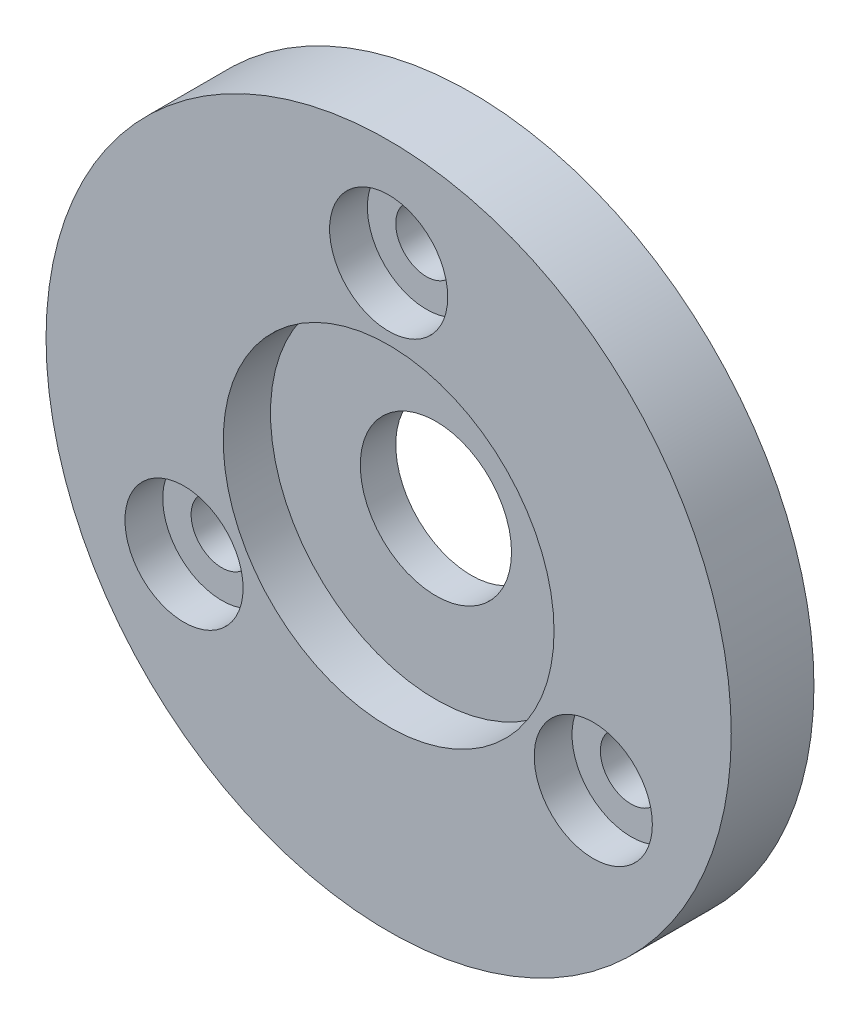
from build123d import *

# Parameters (mm, degrees)
SKETCH_1_R                   = 14.5
EXTRUDE_2_DEPTH              = 3.5
SKETCH_4_R                   = 3.2
CUT_EXTRUDE_1_DEPTH          = 21.802644063
HOLE_WIZARD_M2_1_D           = 2.6
HOLE_WIZARD_M2_1_DEPTH       = 5
HOLE_WIZARD_M2_1_CBORE_D     = 5
HOLE_WIZARD_M2_1_CBORE_DEPTH = 1.6
HOLE_WIZARD_M2_1_TIP         = 0.781118805
SKETCH_7_R                   = 7
CUT_EXTRUDE_2_DEPTH          = 2


with BuildPart() as part:
    # 스케치1 → 보스-돌출2 (new body)
    with BuildSketch(Plane.XY):
        Circle(SKETCH_1_R)
    extrude(amount=EXTRUDE_2_DEPTH)

    # 스케치4 → 컷-돌출1 (cut, through all)
    with BuildSketch(Plane.XY.offset(3.5)):
        Circle(SKETCH_4_R)
    extrude(amount=-CUT_EXTRUDE_1_DEPTH, mode=Mode.SUBTRACT)

    # M2 남비 머리 나사용 카운터보어1
    with Locations(Plane(origin=(0, 10, 3.5), x_dir=(1, 0, 0), z_dir=(0, 0, 1))):
        with Locations((0, 0), (-8.660254038, -15), (8.660254038, -15)):
            CounterBoreHole(HOLE_WIZARD_M2_1_D / 2, HOLE_WIZARD_M2_1_CBORE_D / 2, HOLE_WIZARD_M2_1_CBORE_DEPTH, depth=HOLE_WIZARD_M2_1_DEPTH)
            with Locations((0, 0, -(HOLE_WIZARD_M2_1_DEPTH + HOLE_WIZARD_M2_1_TIP / 2))):  # 118° drill point
                Cone(0, HOLE_WIZARD_M2_1_D / 2, HOLE_WIZARD_M2_1_TIP, mode=Mode.SUBTRACT)

    # 스케치7 → 컷-돌출2 (cut)
    with BuildSketch(Plane.XY.offset(3.5)):
        Circle(SKETCH_7_R)
    extrude(amount=-CUT_EXTRUDE_2_DEPTH, mode=Mode.SUBTRACT)


solid = part.part
